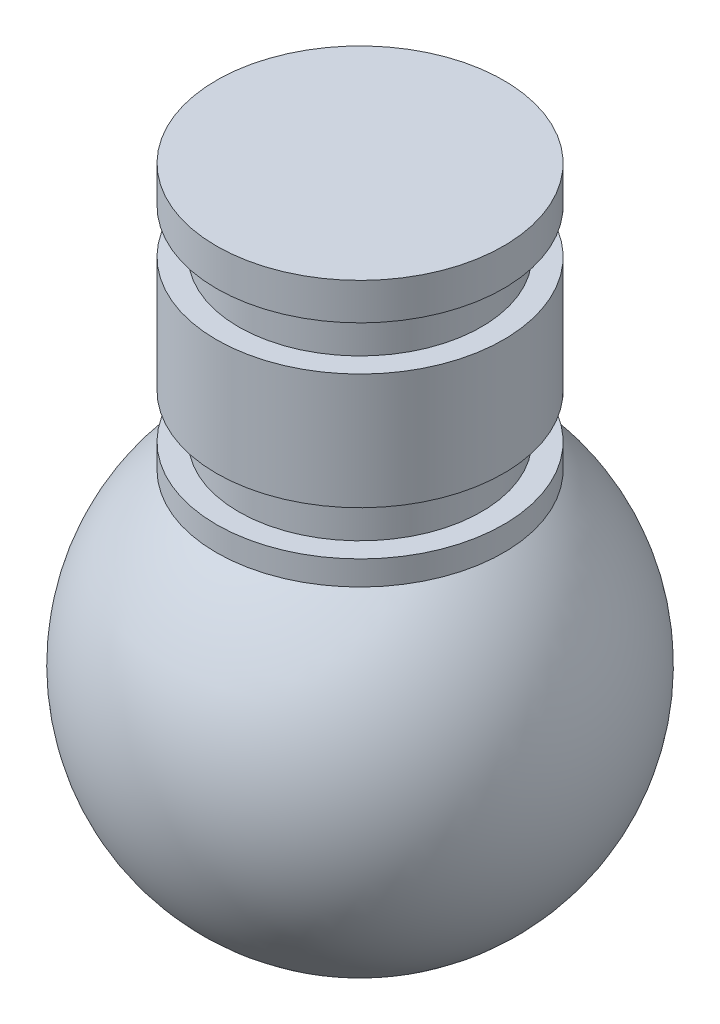
from build123d import *


with BuildPart() as part:
    # Sketch1 → Revolve1 (revolve)
    with BuildSketch(Plane.XY, mode=Mode.PRIVATE) as revolve1_sk:
        with BuildLine():
            Line((6640.084580843, 3596.961198709), (6640.084580843, 3502.981198709))
            ThreePointArc((6640.084580843, 3502.981198709), (6610.286564464, 3523.770326487), (6619.510580843, 3558.913279348))
            Line((6619.510580843, 3558.913279348), (6619.510580843, 3562.400142715))
            Line((6619.510580843, 3562.400142715), (6622.685580843, 3562.400142715))
            Line((6622.685580843, 3562.400142715), (6622.685580843, 3568.750142715))
            Line((6622.685580843, 3568.750142715), (6619.510580843, 3568.750142715))
            Line((6619.510580843, 3568.750142715), (6619.510580843, 3585.338770448))
            Line((6619.510580843, 3585.338770448), (6622.685580843, 3585.338770448))
            Line((6622.685580843, 3585.338770448), (6622.685580843, 3591.688770448))
            Line((6622.685580843, 3591.688770448), (6619.510580843, 3591.688770448))
            Line((6619.510580843, 3591.688770448), (6619.510580843, 3596.961198709))
            Line((6619.510580843, 3596.961198709), (6640.084580843, 3596.961198709))
        make_face()
    revolve(revolve1_sk.sketch.rotate(Axis((6640.084580843, 3596.961198709, 0), (0, -1, 0)), 270), axis=Axis((6640.084580843, 3596.961198709, 0), (0, -1, 0)))


solid = part.part
